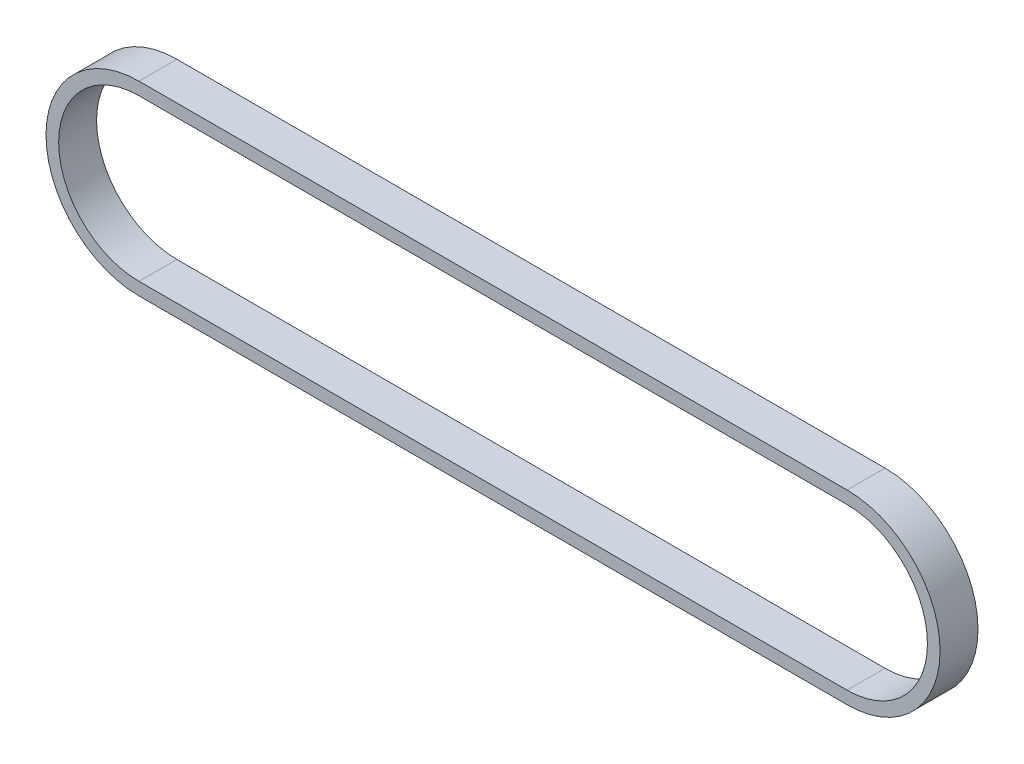
from build123d import *

# Parameters (mm, degrees)
BOSS_EXTRUDE1_DEPTH = 6


with BuildPart() as part:
    # Sketch1 → Boss-Extrude1 (new body)
    with BuildSketch(Plane.XY):
        with BuildLine():
            Line((0, 14.71), (112, 14.71))
            ThreePointArc((112, 14.71), (126.71, 0), (112, -14.71))
            Line((112, -14.71), (0, -14.71))
            ThreePointArc((0, -14.71), (-14.71, 0), (0, 14.71))
        make_face()
        with BuildLine():
            Line((0, 12.71), (112, 12.71))
            ThreePointArc((112, 12.71), (124.71, 0), (112, -12.71))
            Line((112, -12.71), (0, -12.71))
            ThreePointArc((0, -12.71), (-12.71, 0), (0, 12.71))
        make_face(mode=Mode.SUBTRACT)
    extrude(amount=BOSS_EXTRUDE1_DEPTH)


solid = part.part
